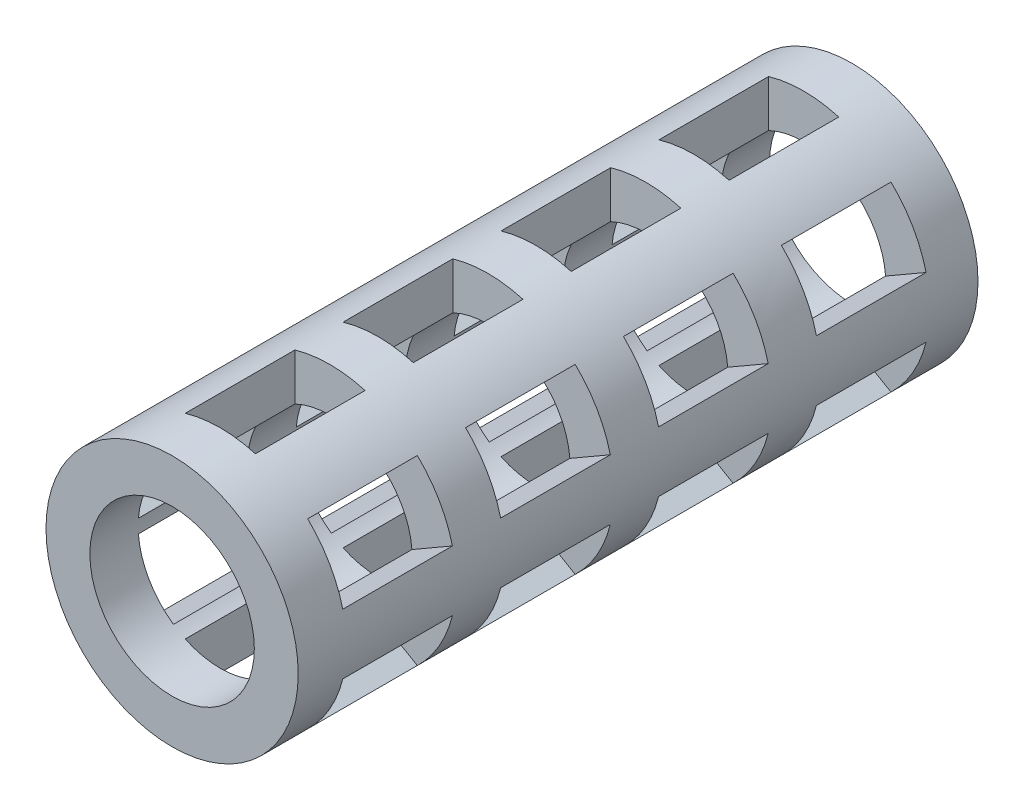
from build123d import *

# Parameters (mm, degrees)
SKETCH_1_R               = 5.75
SKETCH_1_R_2             = 4.75
SKETCH_1_R_3             = 3.75
EXTRUDE_1_DEPTH          = 31
SKETCH_2_W               = 3.2
SKETCH_2_H               = 5
CUT_EXTRUDE_1_DEPTH      = 33.048790929
PATTERN_CIRCULAR_1_COUNT = 3


with BuildPart() as part:
    # 草图1 → 凸台-拉伸1 (new body)
    # profile 1 of 2: a face of its own
    with BuildSketch(Plane.XY):
        Circle(SKETCH_1_R)
        Circle(SKETCH_1_R_2, mode=Mode.SUBTRACT)
    # profile 2 of 2: a face of its own
    with BuildSketch(Plane.XY):
        Circle(SKETCH_1_R_2)
        Circle(SKETCH_1_R_3, mode=Mode.SUBTRACT)
    extrude(amount=EXTRUDE_1_DEPTH)

    # 草图2 → 切除-拉伸1 (cut, symmetric)
    with BuildSketch(Plane(origin=(0, 0, 0), x_dir=(1, 0, 0), z_dir=(0, 1, 0))):
        with Locations((0, -4.7)):
            Rectangle(SKETCH_2_W, SKETCH_2_H)
        with Locations((0, -11.9)):
            Rectangle(SKETCH_2_W, SKETCH_2_H)
        with Locations((0, -19.1)):
            Rectangle(SKETCH_2_W, SKETCH_2_H)
        with Locations((0, -26.3)):
            Rectangle(SKETCH_2_W, SKETCH_2_H)
    cut_extrude_1 = extrude(amount=CUT_EXTRUDE_1_DEPTH, both=True, mode=Mode.SUBTRACT)

    # 阵列(圆周)1: 切除-拉伸1 ×3 about axis
    pattern_circular_1_axis = Axis((0, 0, 0), (0, 0, 1))
    for i in range(1, PATTERN_CIRCULAR_1_COUNT):
        add(cut_extrude_1.rotate(pattern_circular_1_axis, i * 360 / PATTERN_CIRCULAR_1_COUNT), mode=Mode.SUBTRACT)


solid = part.part
